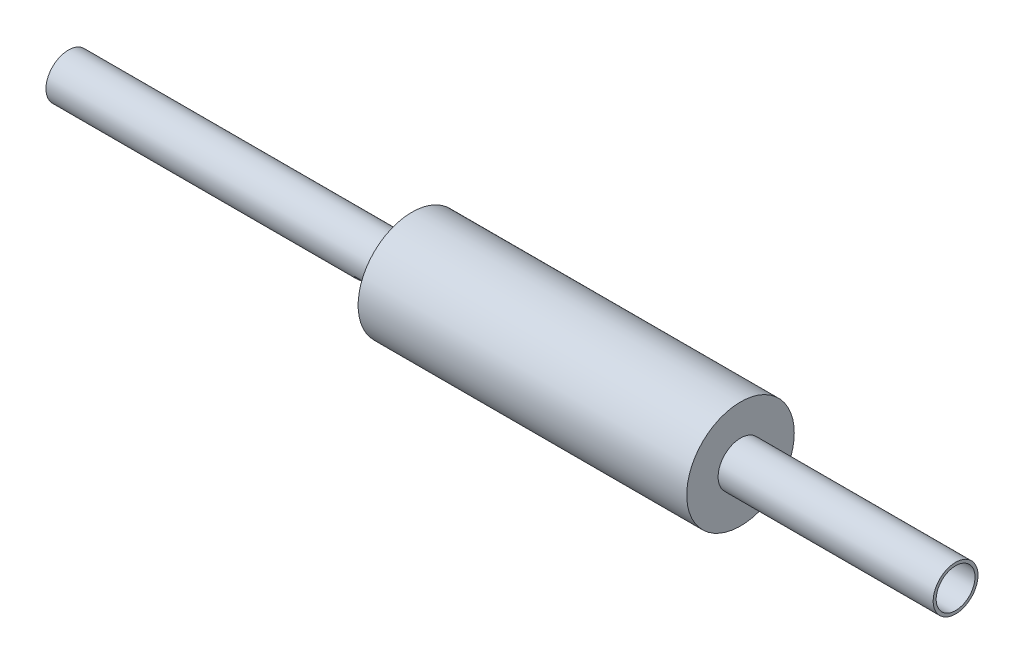
from build123d import *

# Parameters (mm, degrees)
CUT_EXTRUDE1_REACH      = 173.895
CUT_EXTRUDE1_END_RADIUS = 7.5
SKETCH2_W               = 8
SKETCH2_H               = 13


with BuildPart() as part:
    # Sketch1 → Revolve1 (revolve)
    with BuildSketch(Plane.XY, mode=Mode.PRIVATE) as revolve1_sk:
        Polygon((127, 6.5), (127, 7.5), (55, 7.5), (55, 18), (-55, 18), (-55, 7.5), (-170, 7.5), (-170, 6.5), align=None)
    revolve(revolve1_sk.sketch.rotate(Axis((196.356223274, 0, 0), (-1, 0, 0)), 90), axis=Axis((196.356223274, 0, 0), (-1, 0, 0)))

    # Cut-Extrude1: up to this cylinder (the profile starts inside it)
    cut_extrude1_end = Plane(origin=(-64, 0, 0), z_dir=(1, 0, 0)) * Cylinder(CUT_EXTRUDE1_END_RADIUS, 363.79, mode=Mode.PRIVATE)
    # Sketch2 → Cut-Extrude1 (cut, up to the surface)
    with BuildSketch(Plane(origin=(0, 0, 0), x_dir=(1, 0, 0), z_dir=(0, 1, 0)), mode=Mode.PRIVATE) as cut_extrude1_sk1:
        with Locations((-64, 0)):
            Rectangle(SKETCH2_W, SKETCH2_H)
    cut_extrude1_tool1 = extrude(cut_extrude1_sk1.sketch, amount=-CUT_EXTRUDE1_REACH, mode=Mode.PRIVATE) & cut_extrude1_end
    add(cut_extrude1_tool1.solids().sort_by_distance((-64, 0, 0))[0], mode=Mode.SUBTRACT)


solid = part.part
